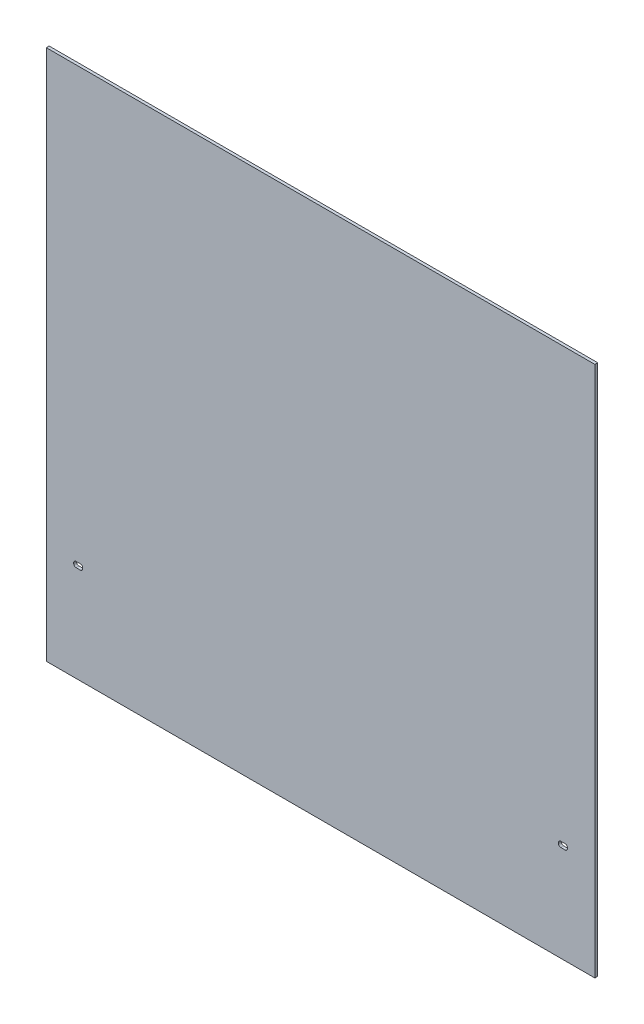
from build123d import *

# Parameters (mm, degrees)
SKETCH1_W           = 609.6
SKETCH1_H           = 590.55
BOSS_EXTRUDE1_DEPTH = 3.175


with BuildPart() as part:
    # Sketch1 → Boss-Extrude1 (new body)
    with BuildSketch(Plane.XY):
        with Locations((-304.8, 295.275)):
            Rectangle(SKETCH1_W, SKETCH1_H)
        with BuildLine():
            Line((-579.12, 109.18), (-579.12, 110.18))
            ThreePointArc((-579.12, 110.18), (-578.387766953, 111.947766953), (-576.62, 112.68))
            Line((-576.62, 112.68), (-571.62, 112.68))
            ThreePointArc((-571.62, 112.68), (-569.852233047, 111.947766953), (-569.12, 110.18))
            Line((-569.12, 110.18), (-569.12, 109.18))
            ThreePointArc((-569.12, 109.18), (-569.852233047, 107.412233047), (-571.62, 106.68))
            Line((-571.62, 106.68), (-576.62, 106.68))
            ThreePointArc((-576.62, 106.68), (-578.387766953, 107.412233047), (-579.12, 109.18))
        make_face(mode=Mode.SUBTRACT)
        with BuildLine():
            Line((-32.98, 106.68), (-37.98, 106.68))
            ThreePointArc((-37.98, 106.68), (-39.747766953, 107.412233047), (-40.48, 109.18))
            Line((-40.48, 109.18), (-40.48, 110.18))
            ThreePointArc((-40.48, 110.18), (-39.747766953, 111.947766953), (-37.98, 112.68))
            Line((-37.98, 112.68), (-32.98, 112.68))
            ThreePointArc((-32.98, 112.68), (-31.212233047, 111.947766953), (-30.48, 110.18))
            Line((-30.48, 110.18), (-30.48, 109.18))
            ThreePointArc((-30.48, 109.18), (-31.212233047, 107.412233047), (-32.98, 106.68))
        make_face(mode=Mode.SUBTRACT)
    extrude(amount=BOSS_EXTRUDE1_DEPTH)


solid = part.part
